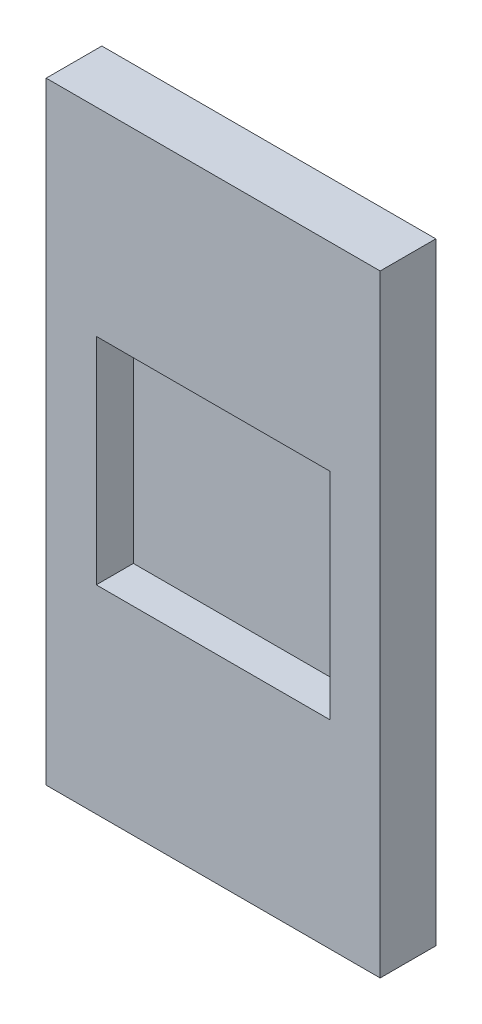
from build123d import *

# Parameters (mm, degrees)
SKETCH_1_W          = 18
SKETCH_1_H          = 33
EXTRUDE_1_DEPTH     = 3
SKETCH_2_W          = 12.6
SKETCH_2_H          = 11.6
CUT_EXTRUDE_1_DEPTH = 2


with BuildPart() as part:
    # 스케치1 → 보스-돌출1 (new body)
    with BuildSketch(Plane.XY):
        Rectangle(SKETCH_1_W, SKETCH_1_H)
    extrude(amount=EXTRUDE_1_DEPTH)

    # 스케치2 → 컷-돌출1 (cut)
    with BuildSketch(Plane.XY.offset(3)):
        Rectangle(SKETCH_2_W, SKETCH_2_H)
    extrude(amount=-CUT_EXTRUDE_1_DEPTH, mode=Mode.SUBTRACT)


solid = part.part
